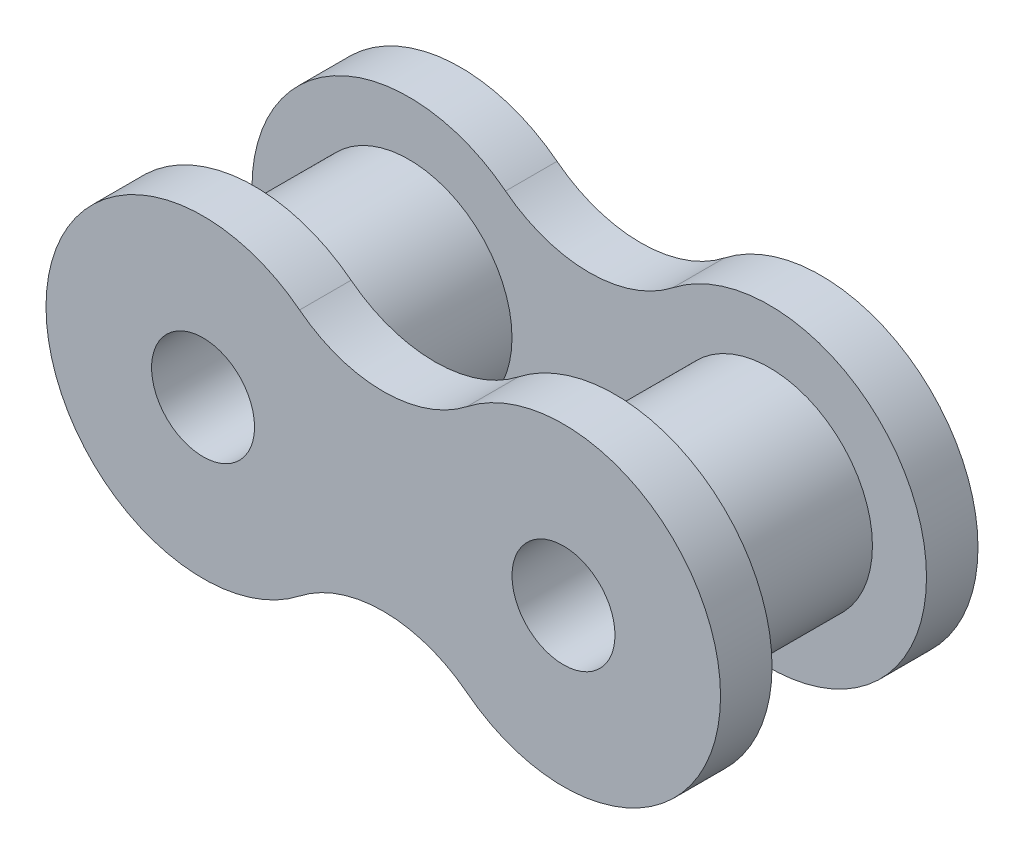
from build123d import *

# Parameters (mm, degrees)
CROQUIS1_R              = 2
SALIENTE_EXTRUIR1_DEPTH = 2
CROQUIS3_R              = 4
CROQUIS3_R_2            = 2
SALIENTE_EXTRUIR2_DEPTH = 8


with BuildPart() as part:
    # Croquis1 → Saliente-Extruir1 (new body)
    with BuildSketch(Plane.XY):
        with BuildLine():
            ThreePointArc((-3.250445743, 4.811532279), (-13.1, 0), (-3.250445743, -4.811532279))
            ThreePointArc((-3.250445743, -4.811532279), (0, -3.694574334), (3.250445743, -4.811532279))
            ThreePointArc((3.250445743, -4.811532279), (13.1, 0), (3.250445743, 4.811532279))
            ThreePointArc((3.250445743, 4.811532279), (0, 3.694574334), (-3.250445743, 4.811532279))
        make_face()
        with Locations((-7, 0)):
            Circle(CROQUIS1_R, mode=Mode.SUBTRACT)
        with Locations(Location((7, 0, 0), (0, 0, 180))):
            Circle(CROQUIS1_R, mode=Mode.SUBTRACT)
    saliente_extruir1 = extrude(amount=SALIENTE_EXTRUIR1_DEPTH)

    # Croquis3 → Saliente-Extruir2 (add)
    # profile 1 of 2: a face of its own
    with BuildSketch(Plane.XY.offset(2)):
        with Locations((-7, 0)):
            Circle(CROQUIS3_R)
        with Locations((-7, 0)):
            Circle(CROQUIS3_R_2, mode=Mode.SUBTRACT)
    # profile 2 of 2: a face of its own
    with BuildSketch(Plane.XY.offset(2)):
        with Locations((7, 0)):
            Circle(CROQUIS3_R)
        with Locations(Location((7, 0, 0), (0, 0, 180))):
            Circle(CROQUIS3_R_2, mode=Mode.SUBTRACT)
    extrude(amount=SALIENTE_EXTRUIR2_DEPTH)

    # Simetría1: Saliente-Extruir1 across plane
    add(saliente_extruir1.mirror(Plane.XY.offset(5)))


solid = part.part
